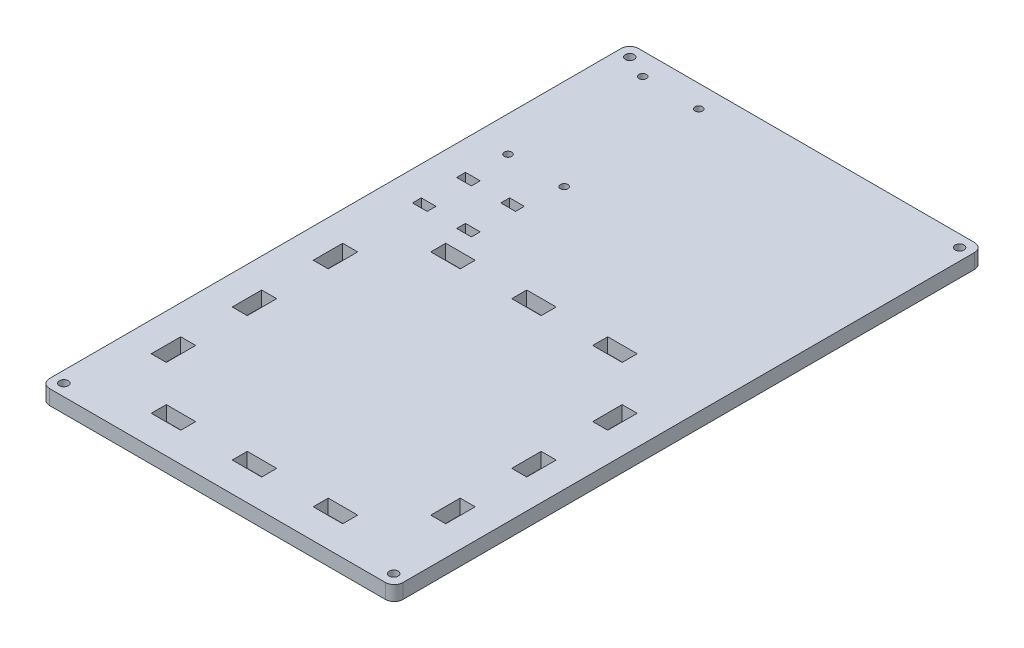
from build123d import *

# Parameters (mm, degrees)
SKETCH1_W           = 120
SKETCH1_H           = 200
SKETCH1_R           = 1.5
SKETCH1_R_2         = 1.27
SKETCH1_W_2         = 5
SKETCH1_H_2         = 3
BOSS_EXTRUDE1_DEPTH = 5
CUT_EXTRUDE1_REACH  = 118.726
SKETCH4_W           = 5.1
SKETCH4_H           = 10
SKETCH4_W_2         = 10
SKETCH4_H_2         = 5.1
FILLET1_R           = 3


with BuildPart() as part:
    # Sketch1 → Boss-Extrude1 (new body)
    with BuildSketch(Plane(origin=(0, 0, 0), x_dir=(1, 0, 0), z_dir=(0, 1, 0))):
        Rectangle(SKETCH1_W, SKETCH1_H)
        with Locations(Location((-56, 96, 0), (0, 0, 270))):
            Circle(SKETCH1_R, mode=Mode.SUBTRACT)
        with Locations(Location((56, 96, 0), (0, 0, 270))):
            Circle(SKETCH1_R, mode=Mode.SUBTRACT)
        with Locations(Location((55.822222222, -96, 0), (0, 0, 270))):
            Circle(SKETCH1_R, mode=Mode.SUBTRACT)
        with Locations(Location((-56.177777778, -96, 0), (0, 0, 270))):
            Circle(SKETCH1_R, mode=Mode.SUBTRACT)
        with Locations(Location((-48.095, 92.46, 0), (0, 0, 270))):
            Circle(SKETCH1_R_2, mode=Mode.SUBTRACT)
        with Locations(Location((-29.045, 92.46, 0), (0, 0, 270))):
            Circle(SKETCH1_R_2, mode=Mode.SUBTRACT)
        with Locations(Location((-29.045, 46.74, 0), (0, 0, 270))):
            Circle(SKETCH1_R_2, mode=Mode.SUBTRACT)
        with Locations(Location((-48.095, 46.74, 0), (0, 0, 270))):
            Circle(SKETCH1_R_2, mode=Mode.SUBTRACT)
        with Locations((-32.5, 32.7)):
            Rectangle(SKETCH1_W_2, SKETCH1_H_2, mode=Mode.SUBTRACT)
        with Locations((-47.5, 32.7)):
            Rectangle(SKETCH1_W_2, SKETCH1_H_2, mode=Mode.SUBTRACT)
        with Locations((-32.5, 17.7)):
            Rectangle(SKETCH1_W_2, SKETCH1_H_2, mode=Mode.SUBTRACT)
        with Locations((-47.5, 17.7)):
            Rectangle(SKETCH1_W_2, SKETCH1_H_2, mode=Mode.SUBTRACT)
    extrude(amount=BOSS_EXTRUDE1_DEPTH)

    # Sketch4 → Cut-Extrude1 (cut, up to next)
    with BuildSketch(Plane(origin=(0, 5, 0), x_dir=(1, 0, 0), z_dir=(0, 1, 0)), mode=Mode.PRIVATE) as cut_extrude1_sk1:
        with Locations((-47.45, -12.5)):
            Rectangle(SKETCH4_W, SKETCH4_H)
    cut_extrude1_tool1 = extrude(cut_extrude1_sk1.sketch, amount=-CUT_EXTRUDE1_REACH, mode=Mode.PRIVATE) & part.part
    # Sketch4 → Cut-Extrude1 (cut, up to next)
    with BuildSketch(Plane(origin=(0, 5, 0), x_dir=(1, 0, 0), z_dir=(0, 1, 0)), mode=Mode.PRIVATE) as cut_extrude1_sk2:
        with Locations((-47.45, -67.5)):
            Rectangle(SKETCH4_W, SKETCH4_H)
    cut_extrude1_tool2 = extrude(cut_extrude1_sk2.sketch, amount=-CUT_EXTRUDE1_REACH, mode=Mode.PRIVATE) & part.part
    # Sketch4 → Cut-Extrude1 (cut, up to next)
    with BuildSketch(Plane(origin=(0, 5, 0), x_dir=(1, 0, 0), z_dir=(0, 1, 0)), mode=Mode.PRIVATE) as cut_extrude1_sk3:
        with Locations((-47.45, -40)):
            Rectangle(SKETCH4_W, SKETCH4_H)
    cut_extrude1_tool3 = extrude(cut_extrude1_sk3.sketch, amount=-CUT_EXTRUDE1_REACH, mode=Mode.PRIVATE) & part.part
    # Sketch4 → Cut-Extrude1 (cut, up to next)
    with BuildSketch(Plane(origin=(0, 5, 0), x_dir=(1, 0, 0), z_dir=(0, 1, 0)), mode=Mode.PRIVATE) as cut_extrude1_sk4:
        with Locations((-27.5, 7.45)):
            Rectangle(SKETCH4_W_2, SKETCH4_H_2)
    cut_extrude1_tool4 = extrude(cut_extrude1_sk4.sketch, amount=-CUT_EXTRUDE1_REACH, mode=Mode.PRIVATE) & part.part
    # Sketch4 → Cut-Extrude1 (cut, up to next)
    with BuildSketch(Plane(origin=(0, 5, 0), x_dir=(1, 0, 0), z_dir=(0, 1, 0)), mode=Mode.PRIVATE) as cut_extrude1_sk5:
        with Locations((0, 7.45)):
            Rectangle(SKETCH4_W_2, SKETCH4_H_2)
    cut_extrude1_tool5 = extrude(cut_extrude1_sk5.sketch, amount=-CUT_EXTRUDE1_REACH, mode=Mode.PRIVATE) & part.part
    # Sketch4 → Cut-Extrude1 (cut, up to next)
    with BuildSketch(Plane(origin=(0, 5, 0), x_dir=(1, 0, 0), z_dir=(0, 1, 0)), mode=Mode.PRIVATE) as cut_extrude1_sk6:
        with Locations((27.5, 7.45)):
            Rectangle(SKETCH4_W_2, SKETCH4_H_2)
    cut_extrude1_tool6 = extrude(cut_extrude1_sk6.sketch, amount=-CUT_EXTRUDE1_REACH, mode=Mode.PRIVATE) & part.part
    # Sketch4 → Cut-Extrude1 (cut, up to next)
    with BuildSketch(Plane(origin=(0, 5, 0), x_dir=(1, 0, 0), z_dir=(0, 1, 0)), mode=Mode.PRIVATE) as cut_extrude1_sk7:
        with Locations((47.45, -12.5)):
            Rectangle(SKETCH4_W, SKETCH4_H)
    cut_extrude1_tool7 = extrude(cut_extrude1_sk7.sketch, amount=-CUT_EXTRUDE1_REACH, mode=Mode.PRIVATE) & part.part
    # Sketch4 → Cut-Extrude1 (cut, up to next)
    with BuildSketch(Plane(origin=(0, 5, 0), x_dir=(1, 0, 0), z_dir=(0, 1, 0)), mode=Mode.PRIVATE) as cut_extrude1_sk8:
        with Locations((47.45, -40)):
            Rectangle(SKETCH4_W, SKETCH4_H)
    cut_extrude1_tool8 = extrude(cut_extrude1_sk8.sketch, amount=-CUT_EXTRUDE1_REACH, mode=Mode.PRIVATE) & part.part
    # Sketch4 → Cut-Extrude1 (cut, up to next)
    with BuildSketch(Plane(origin=(0, 5, 0), x_dir=(1, 0, 0), z_dir=(0, 1, 0)), mode=Mode.PRIVATE) as cut_extrude1_sk9:
        with Locations((47.45, -67.5)):
            Rectangle(SKETCH4_W, SKETCH4_H)
    cut_extrude1_tool9 = extrude(cut_extrude1_sk9.sketch, amount=-CUT_EXTRUDE1_REACH, mode=Mode.PRIVATE) & part.part
    # Sketch4 → Cut-Extrude1 (cut, up to next)
    with BuildSketch(Plane(origin=(0, 5, 0), x_dir=(1, 0, 0), z_dir=(0, 1, 0)), mode=Mode.PRIVATE) as cut_extrude1_sk10:
        with Locations((0, -87.45)):
            Rectangle(SKETCH4_W_2, SKETCH4_H_2)
    cut_extrude1_tool10 = extrude(cut_extrude1_sk10.sketch, amount=-CUT_EXTRUDE1_REACH, mode=Mode.PRIVATE) & part.part
    # Sketch4 → Cut-Extrude1 (cut, up to next)
    with BuildSketch(Plane(origin=(0, 5, 0), x_dir=(1, 0, 0), z_dir=(0, 1, 0)), mode=Mode.PRIVATE) as cut_extrude1_sk11:
        with Locations((-27.5, -87.45)):
            Rectangle(SKETCH4_W_2, SKETCH4_H_2)
    cut_extrude1_tool11 = extrude(cut_extrude1_sk11.sketch, amount=-CUT_EXTRUDE1_REACH, mode=Mode.PRIVATE) & part.part
    # Sketch4 → Cut-Extrude1 (cut, up to next)
    with BuildSketch(Plane(origin=(0, 5, 0), x_dir=(1, 0, 0), z_dir=(0, 1, 0)), mode=Mode.PRIVATE) as cut_extrude1_sk12:
        with Locations((27.5, -87.45)):
            Rectangle(SKETCH4_W_2, SKETCH4_H_2)
    cut_extrude1_tool12 = extrude(cut_extrude1_sk12.sketch, amount=-CUT_EXTRUDE1_REACH, mode=Mode.PRIVATE) & part.part
    add(cut_extrude1_tool1.solids().sort_by_distance((-47.45, 5, 12.5))[0], mode=Mode.SUBTRACT)
    add(cut_extrude1_tool2.solids().sort_by_distance((-47.45, 5, 67.5))[0], mode=Mode.SUBTRACT)
    add(cut_extrude1_tool3.solids().sort_by_distance((-47.45, 5, 40))[0], mode=Mode.SUBTRACT)
    add(cut_extrude1_tool4.solids().sort_by_distance((-27.5, 5, -7.45))[0], mode=Mode.SUBTRACT)
    add(cut_extrude1_tool5.solids().sort_by_distance((0, 5, -7.45))[0], mode=Mode.SUBTRACT)
    add(cut_extrude1_tool6.solids().sort_by_distance((27.5, 5, -7.45))[0], mode=Mode.SUBTRACT)
    add(cut_extrude1_tool7.solids().sort_by_distance((47.45, 5, 12.5))[0], mode=Mode.SUBTRACT)
    add(cut_extrude1_tool8.solids().sort_by_distance((47.45, 5, 40))[0], mode=Mode.SUBTRACT)
    add(cut_extrude1_tool9.solids().sort_by_distance((47.45, 5, 67.5))[0], mode=Mode.SUBTRACT)
    add(cut_extrude1_tool10.solids().sort_by_distance((0, 5, 87.45))[0], mode=Mode.SUBTRACT)
    add(cut_extrude1_tool11.solids().sort_by_distance((-27.5, 5, 87.45))[0], mode=Mode.SUBTRACT)
    add(cut_extrude1_tool12.solids().sort_by_distance((27.5, 5, 87.45))[0], mode=Mode.SUBTRACT)

    # Fillet1
    fillet1_edges = [part.edges().sort_by_distance(p)[0] for p in [
        (-60, 2.5, 100),
        (-60, 2.5, -100),
        (60, 2.5, -100),
        (60, 2.5, 100),
    ]]
    fillet(fillet1_edges, radius=FILLET1_R)


solid = part.part
